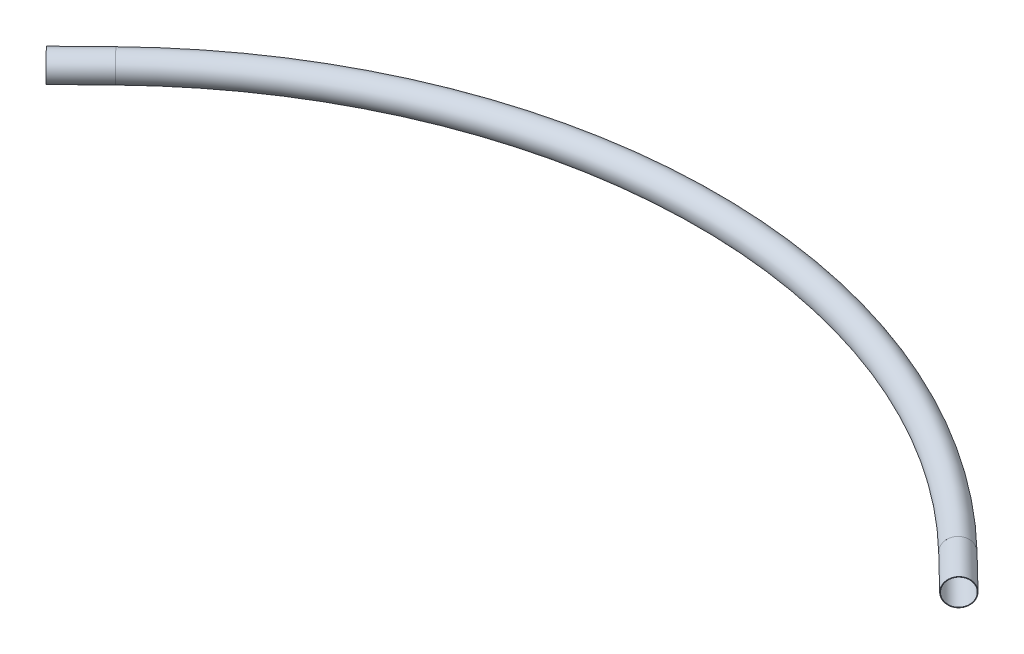
from build123d import *

# Parameters (mm, degrees)
SKETCH12_R                 = 84.1375
SKETCH12_R_2               = 80.7339
STRUCTURAL_MEMBER1_DEPTH   = 304.8
SKETCH12_ON_SEGMENT_2_R    = 84.1375
SKETCH12_ON_SEGMENT_2_R_2  = 80.7339
STRUCTURAL_MEMBER1_2_ANGLE = 88.404158125
SKETCH12_ON_SEGMENT_3_R    = 84.1375
SKETCH12_ON_SEGMENT_3_R_2  = 80.7339
STRUCTURAL_MEMBER1_3_DEPTH = 304.8


with BuildPart() as part:
    # Sketch12 → Structural Member1 (new body)
    with BuildSketch(Plane(origin=(2611.4375, 0, 0), x_dir=(-0.6971911165647129, 0, 0.7168853095044206), z_dir=(-0.7168853095044206, 0, -0.6971911165647129))):
        Circle(SKETCH12_R)
        Circle(SKETCH12_R_2, mode=Mode.SUBTRACT)
    extrude(amount=-STRUCTURAL_MEMBER1_DEPTH)


with BuildPart() as body_2:
    # Sketch12 on segment 2 (carried to the start of arc 2) → Structural Member1 2 (revolve)
    with BuildSketch(Plane(origin=(2611.4375, 0, 0), x_dir=(0.697191117, 0, -0.71688531), z_dir=(0.71688531, 0, 0.697191117))):
        Circle(SKETCH12_ON_SEGMENT_2_R)
        Circle(SKETCH12_ON_SEGMENT_2_R_2, mode=Mode.SUBTRACT)
    revolve(axis=Axis((0, 0, 2685.205155314), (0, 1, 0)), revolution_arc=STRUCTURAL_MEMBER1_2_ANGLE)


with BuildPart() as body_3:
    # Sketch12 on segment 3 (carried to segment 3) → Structural Member1 3 (new body)
    with BuildSketch(Plane(origin=(-2829.944142337, 0, 212.503852329), x_dir=(-0.697191117, 0, -0.71688531), z_dir=(0.71688531, 0, -0.697191117))):
        Circle(SKETCH12_ON_SEGMENT_3_R)
        Circle(SKETCH12_ON_SEGMENT_3_R_2, mode=Mode.SUBTRACT)
    extrude(amount=STRUCTURAL_MEMBER1_3_DEPTH)


solid = Compound([part.part, body_2.part, body_3.part])
